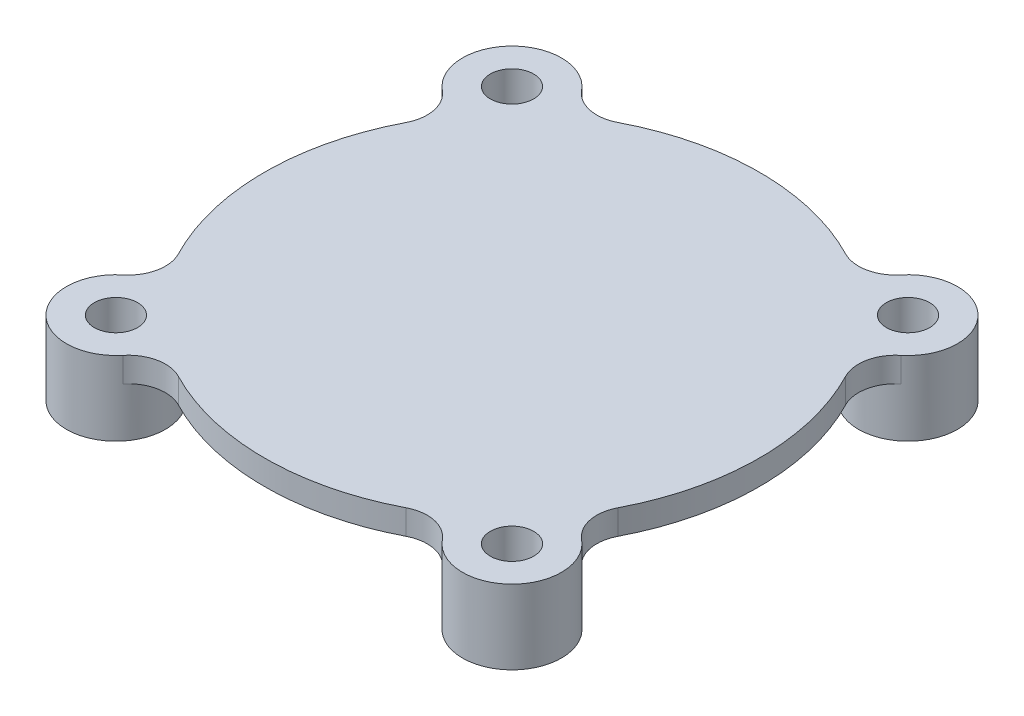
from build123d import *

# Parameters (mm, degrees)
BOSS_EXTRUDE1_DEPTH        = 2
FILLET1_R                  = 3
BOSS_EXTRUDE2_START        = -4
SKETCH1_3_R                = 4
BOSS_EXTRUDE2_DEPTH        = 4
F_3_5_3_5_DIAMETER_HOLE1_D = 3.5


with BuildPart() as part:
    # Sketch1 → Boss-Extrude1 (new body)
    with BuildSketch(Plane(origin=(0, 0, 0), x_dir=(1, 0, 0), z_dir=(0, 1, 0))):
        with BuildLine():
            ThreePointArc((16, -12), (20, 0), (16, 12))
            ThreePointArc((16, 12), (18.828427125, 18.828427125), (12, 16))
            ThreePointArc((12, 16), (0, 20), (-12, 16))
            ThreePointArc((-12, 16), (-18.828427125, 18.828427125), (-16, 12))
            ThreePointArc((-16, 12), (-20, 0), (-16, -12))
            ThreePointArc((-16, -12), (-18.828427125, -18.828427125), (-12, -16))
            ThreePointArc((-12, -16), (0, -20), (12, -16))
            ThreePointArc((12, -16), (18.828427125, -18.828427125), (16, -12))
        make_face()
    extrude(amount=BOSS_EXTRUDE1_DEPTH)

    # Fillet1
    fillet1_edges = [part.edges().sort_by_distance(p)[0] for p in [
        (-16, 1, 12),
        (-16, 1, -12),
        (12, 1, -16),
        (16, 1, -12),
        (16, 1, 12),
        (12, 1, 16),
        (-12, 1, 16),
        (-12, 1, -16),
    ]]
    fillet(fillet1_edges, radius=FILLET1_R)

    # Sketch1<3> → Boss-Extrude2 (add)
    with BuildSketch(Plane(origin=(0, 0, 0), x_dir=(1, 0, 0), z_dir=(0, 1, 0)).offset(BOSS_EXTRUDE2_START)):
        with Locations((-16, 16)):
            Circle(SKETCH1_3_R)
        with Locations((16, 16)):
            Circle(SKETCH1_3_R)
        with Locations((16, -16)):
            Circle(SKETCH1_3_R)
        with Locations((-16, -16)):
            Circle(SKETCH1_3_R)
    extrude(amount=BOSS_EXTRUDE2_DEPTH)

    # Ø3.5 (3.5) Diameter Hole1 (through all)
    with Locations(Plane(origin=(0, 2, 0), x_dir=(1, 0, 0), z_dir=(0, 1, 0))):
        with Locations((-16, 16), (16, 16), (16, -16), (-16, -16)):
            Hole(F_3_5_3_5_DIAMETER_HOLE1_D / 2)


solid = part.part
